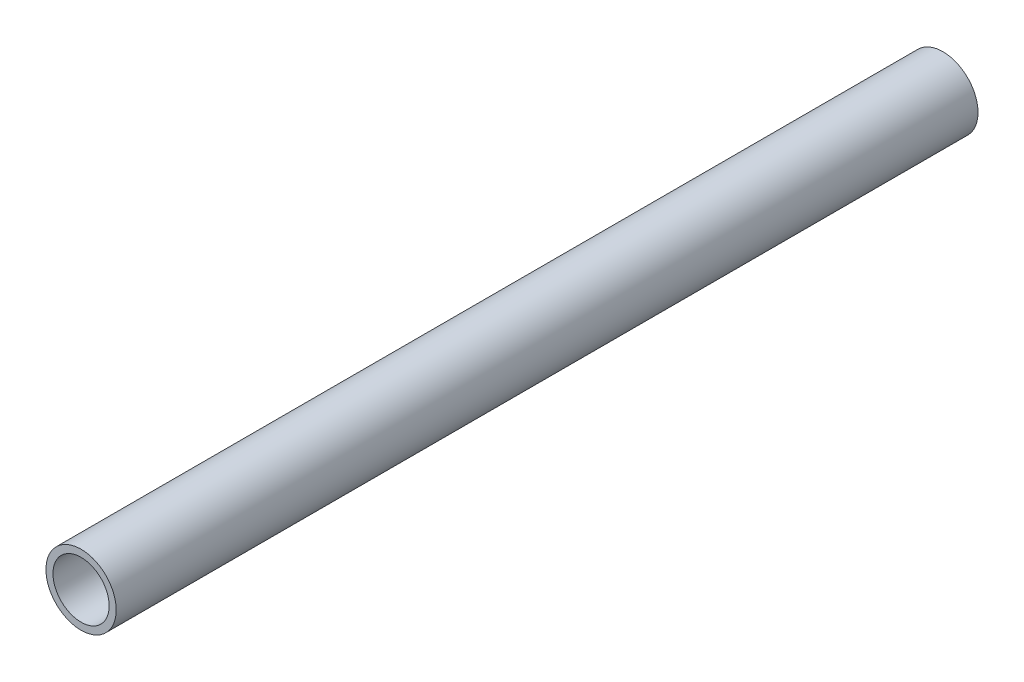
from build123d import *

# Parameters (mm, degrees)
SKETCH_1_R          = 7.5
EXTRUDE_1_DEPTH     = 92
SKETCH_2_R          = 6
CUT_EXTRUDE_1_DEPTH = 34.59
CUT_EXTRUDE_START   = -34.59
SKETCH_3_R          = 6
CUT_EXTRUDE_2_DEPTH = 34.59


with BuildPart() as part:
    # 스케치1 → 보스-돌출1 (new, symmetric)
    with BuildSketch(Plane.XY):
        Circle(SKETCH_1_R)
    extrude(amount=EXTRUDE_1_DEPTH, both=True)

    # 스케치2 → 컷-돌출1 (cut)
    with BuildSketch(Plane.XY.offset(92)):
        Circle(SKETCH_2_R)
    extrude(amount=-CUT_EXTRUDE_1_DEPTH, mode=Mode.SUBTRACT)

    # 스케치3 → 컷-돌출2 (cut)
    with BuildSketch(Plane(origin=(0, 0, -92), x_dir=(-1, 0, 0), z_dir=(0, 0, -1)).offset(CUT_EXTRUDE_START)):
        with Locations(Location((0, 0, 0), (0, 0, 180))):
            Circle(SKETCH_3_R)
    extrude(amount=CUT_EXTRUDE_2_DEPTH, mode=Mode.SUBTRACT)


solid = part.part
